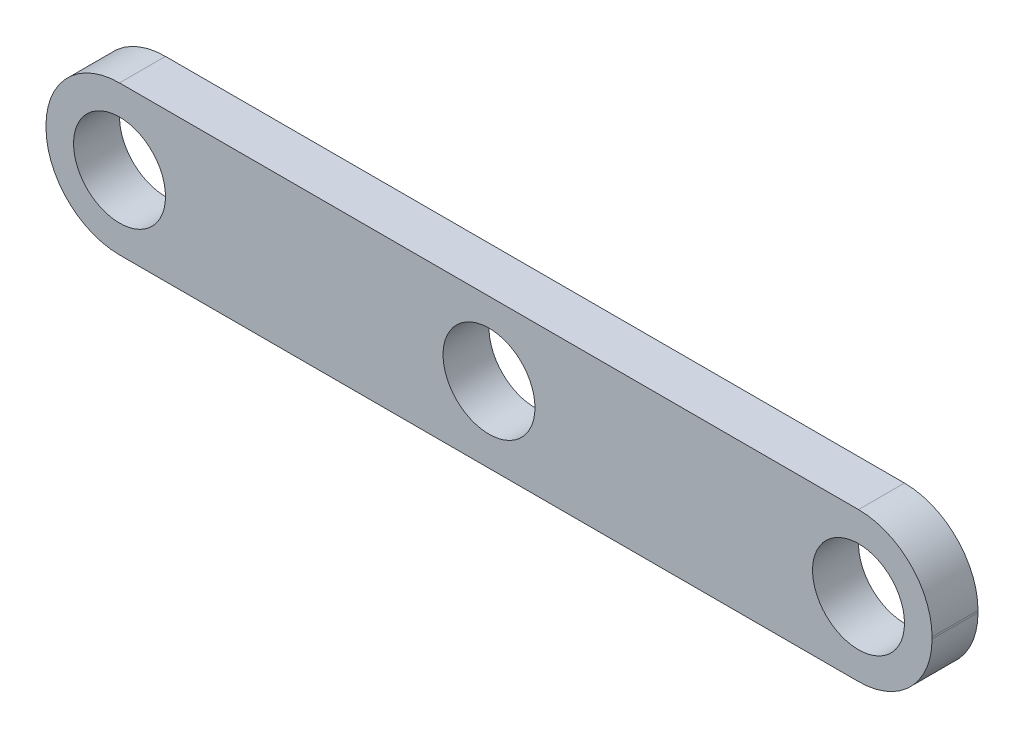
from build123d import *

# Parameters (mm, degrees)
SKETCH1_R           = 10
BOSS_EXTRUDE1_DEPTH = 10


with BuildPart() as part:
    # Sketch1 → Boss-Extrude1 (new body)
    with BuildSketch(Plane.XY):
        with BuildLine():
            Line((-80.773453516, -5.188231867), (80.032214634, -5.188231867))
            ThreePointArc((80.032214634, -5.188231867), (91.345923133, -9.874523368), (96.032214634, -21.188231867))
            Line((96.032214634, -21.188231867), (96.032214634, -21.606884034))
            ThreePointArc((96.032214634, -21.606884034), (91.345923133, -32.920592533), (80.032214634, -37.606884034))
            Line((80.032214634, -37.606884034), (-80.773453516, -37.606884034))
            ThreePointArc((-80.773453516, -37.606884034), (-92.087162015, -32.920592533), (-96.773453516, -21.606884034))
            Line((-96.773453516, -21.606884034), (-96.773453516, -21.188231867))
            ThreePointArc((-96.773453516, -21.188231867), (-92.087162015, -9.874523368), (-80.773453516, -5.188231867))
        make_face()
        with Locations((-80.773453516, -21.606884034)):
            Circle(SKETCH1_R, mode=Mode.SUBTRACT)
        with Locations((80.032214634, -21.606884034)):
            Circle(SKETCH1_R, mode=Mode.SUBTRACT)
        with Locations((-0.370619441, -21.188231867)):
            Circle(SKETCH1_R, mode=Mode.SUBTRACT)
    extrude(amount=BOSS_EXTRUDE1_DEPTH)


solid = part.part
